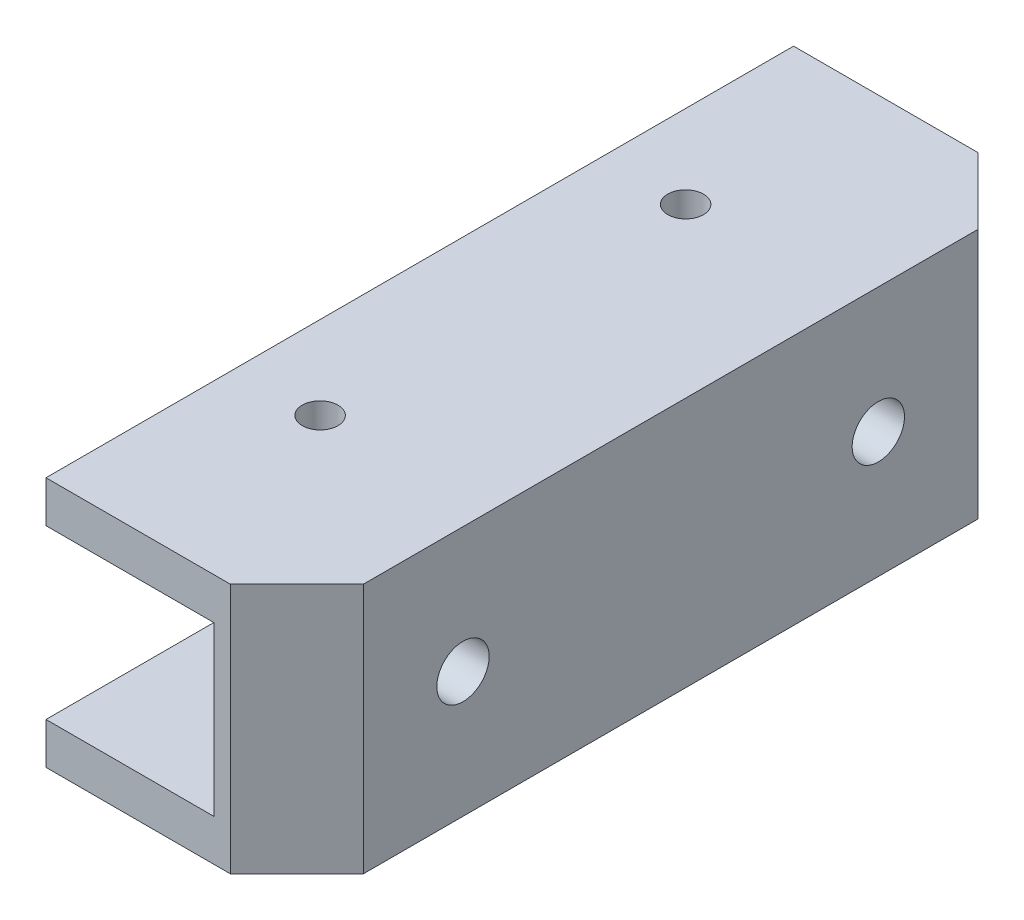
from build123d import *

# Parameters (mm, degrees)
EXTRUDE_1_DEPTH     = 60
SKETCH_4_R          = 2.15
CUT_EXTRUDE_1_DEPTH = 40
SKETCH_5_R          = 3.15
CUT_EXTRUDE_2_DEPTH = 40
EXTRUDE_6_DEPTH     = 15
EXTRUDE_7_DEPTH     = 15
EXTRUDE_START       = 5
SKETCH_12_W         = 90
SKETCH_12_H         = 30.2
SKETCH_12_R         = 3.15
EXTRUDE_8_DEPTH     = 5
CHAMFER_6_SIZE      = 8
SKETCH_13_R         = 7.5
CUT_EXTRUDE_5_DEPTH = 5


with BuildPart() as part:
    # 草图1 → 凸台-拉伸1 (new body)
    with BuildSketch(Plane.XY):
        Polygon((0, 0), (0, -5), (25.2, -5), (25.2, 25.2), (0, 25.2), (0, 20.2), (20.2, 20.2), (20.2, 0), align=None)
    extrude(amount=EXTRUDE_1_DEPTH)

    # 草图4 → 切除-拉伸1 (cut)
    with BuildSketch(Plane(origin=(0, 25.2, 0), x_dir=(1, 0, 0), z_dir=(0, 1, 0))):
        with Locations(Location((10, -8, 0), (0, 0, 270))):
            Circle(SKETCH_4_R)
        with Locations(Location((10, -52, 0), (0, 0, 270))):
            Circle(SKETCH_4_R)
    extrude(amount=-CUT_EXTRUDE_1_DEPTH, mode=Mode.SUBTRACT)

    # 草图5 → 切除-拉伸2 (cut)
    with BuildSketch(Plane(origin=(25.2, 0, 0), x_dir=(0, 0, -1), z_dir=(1, 0, 0))):
        with Locations(Location((-55, 10.1, 0), (0, 0, 90))):
            Circle(SKETCH_5_R)
        with Locations(Location((-5, 10.1, 0), (0, 0, 90))):
            Circle(SKETCH_5_R)
    extrude(amount=-CUT_EXTRUDE_2_DEPTH, mode=Mode.SUBTRACT)

    # 草图10 → 凸台-拉伸6 (add)
    with BuildSketch(Plane(origin=(0, 0, 0), x_dir=(-1, 0, 0), z_dir=(0, 0, -1))):
        Polygon((-20.2, 20.2), (0, 20.2), (0, 25.2), (-25.2, 25.2), (-25.2, -5), (0, -5), (0, 0), (-20.2, 0), align=None)
    extrude(amount=EXTRUDE_6_DEPTH)

    # 草图11 → 凸台-拉伸7 (add)
    with BuildSketch(Plane.XY.offset(60)):
        Polygon((20.2, 0), (0, 0), (0, -5), (25.2, -5), (25.2, 25.2), (0, 25.2), (0, 20.2), (20.2, 20.2), align=None)
    extrude(amount=EXTRUDE_7_DEPTH)

    # 草图12 → 凸台-拉伸8 (add)
    with BuildSketch(Plane(origin=(25.2, 0, 0), x_dir=(0, 0, -1), z_dir=(1, 0, 0)).offset(EXTRUDE_START)):
        with Locations((-30, 10.1)):
            Rectangle(SKETCH_12_W, SKETCH_12_H)
        with Locations(Location((-55, 10.1, 0), (0, 0, 90))):
            Circle(SKETCH_12_R, mode=Mode.SUBTRACT)
        with Locations(Location((-5, 10.1, 0), (0, 0, 90))):
            Circle(SKETCH_12_R, mode=Mode.SUBTRACT)
    extrude(amount=-EXTRUDE_8_DEPTH)

    # 倒角6
    chamfer_6_edges = [part.edges().sort_by_distance(p)[0] for p in [
        (30.2, 10.1, -15),
        (30.2, 10.1, 75),
    ]]
    chamfer(chamfer_6_edges, length=CHAMFER_6_SIZE)

    # 草图13 → 切除-拉伸5 (cut)
    with BuildSketch(Plane.ZY.offset(-20.2)):
        with Locations((5, 10.1)):
            Circle(SKETCH_13_R)
        with Locations((55, 10.1)):
            Circle(SKETCH_13_R)
    extrude(amount=-CUT_EXTRUDE_5_DEPTH, mode=Mode.SUBTRACT)


solid = part.part
